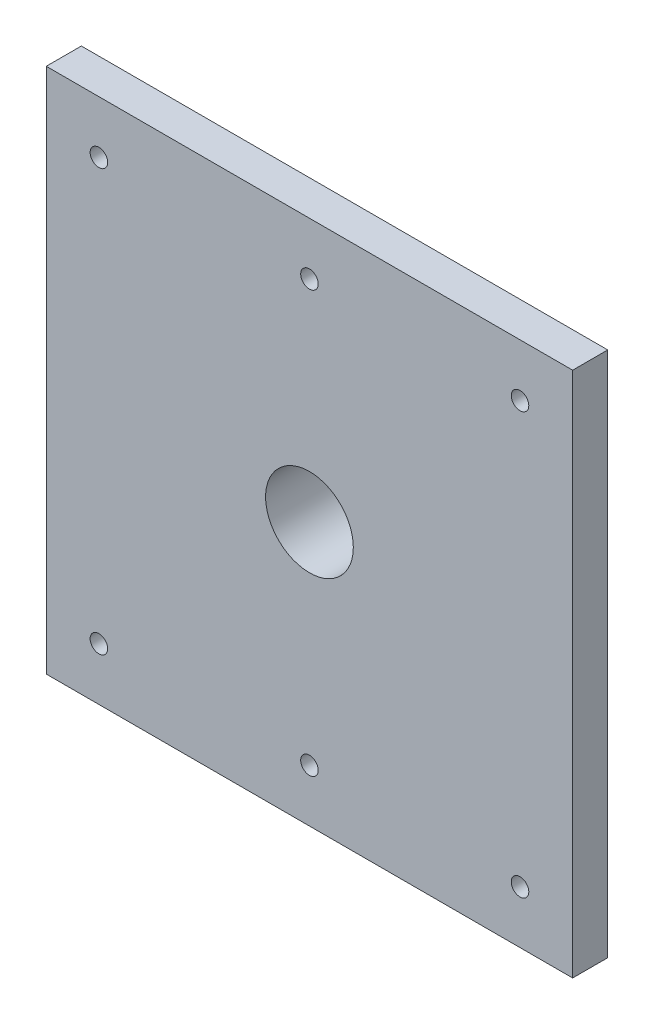
from build123d import *

# Parameters (mm, degrees)
SKETCH_1_R          = 14.5
SKETCH_1_R_2        = 12.5
EXTRUDE_1_DEPTH     = 15
EXTRUDE_START       = 10
SKETCH_1_3_W        = 150
SKETCH_1_3_H        = 150
SKETCH_1_3_R        = 12.5
EXTRUDE_1_2_DEPTH   = 10
SKETCH_2_R          = 2.5
CUT_EXTRUDE_1_DEPTH = 10


with BuildPart() as part:
    # 草图1 → Extrude 1 (new body)
    with BuildSketch(Plane.XY):
        Circle(SKETCH_1_R)
        Circle(SKETCH_1_R_2, mode=Mode.SUBTRACT)
    extrude(amount=-EXTRUDE_1_DEPTH)

    # 草图1<3> → Extrude 1 2 (add)
    with BuildSketch(Plane.XY.offset(EXTRUDE_START)):
        Rectangle(SKETCH_1_3_W, SKETCH_1_3_H)
        Circle(SKETCH_1_3_R, mode=Mode.SUBTRACT)
    extrude(amount=-EXTRUDE_1_2_DEPTH)

    # 草图2 → 切除-拉伸1 (cut)
    with BuildSketch(Plane.XY.offset(10)):
        with Locations((-60, 60)):
            Circle(SKETCH_2_R)
        with Locations((0, 60)):
            Circle(SKETCH_2_R)
        with Locations((60, 60)):
            Circle(SKETCH_2_R)
        with Locations((60, -60)):
            Circle(SKETCH_2_R)
        with Locations((0, -60)):
            Circle(SKETCH_2_R)
        with Locations((-60, -60)):
            Circle(SKETCH_2_R)
    extrude(amount=-CUT_EXTRUDE_1_DEPTH, mode=Mode.SUBTRACT)


solid = part.part
